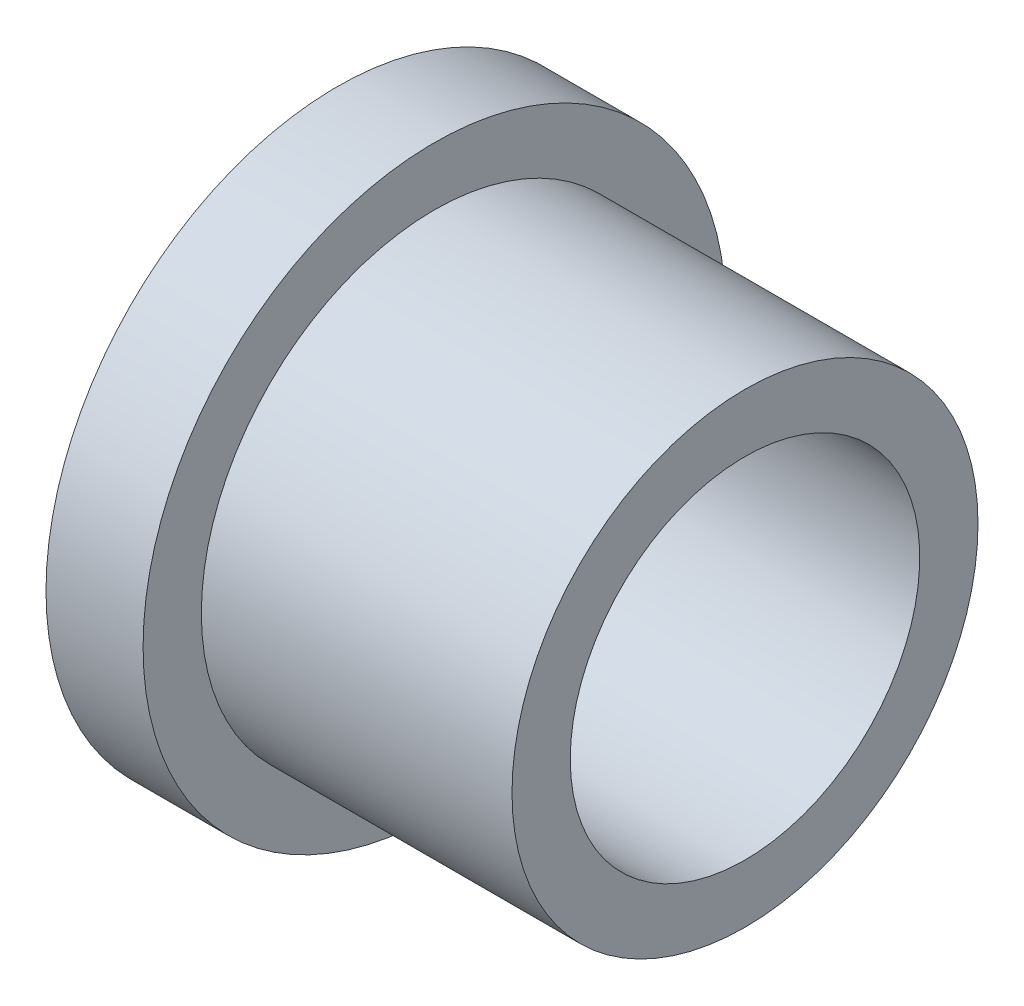
from build123d import *

# Parameters (mm, degrees)
SHELL2_T = -3


with BuildPart() as part:
    # Sketch5 → Revolve11 (revolve)
    with BuildSketch(Plane.XY, mode=Mode.PRIVATE) as revolve11_sk:
        Polygon((-10.5, 0), (10.5, 0), (10.5, 12), (-5.5, 12), (-5.5, 15), (-10.5, 15), align=None)
    revolve(revolve11_sk.sketch.rotate(Axis((-10.5, 0, 0), (1, 0, 0)), 90), axis=Axis((-10.5, 0, 0), (1, 0, 0)))

    # Shell2
    shell2_openings = [part.faces().sort_by_distance(p)[0] for p in [
        (10.5, 0, 0),
        (-10.5, 0, 0),
    ]]
    offset(amount=SHELL2_T, openings=shell2_openings, kind=Kind.INTERSECTION)


solid = part.part
